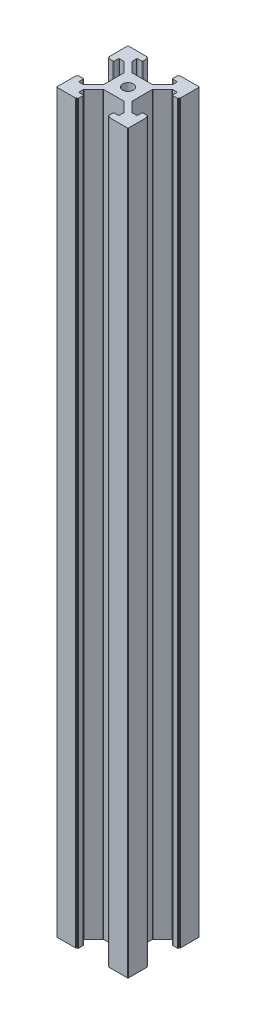
from build123d import *

# Parameters (mm, degrees)
SKETCH1_R               = 1.5
BOSS_EXTRUDE1_DEPTH     = 206
CUT_EXTRUDE1_DEPTH      = 10
CUT_EXTRUDE1_DEPTH_BACK = 10
SKETCH2_R               = 1.5
CUT_EXTRUDE2_DEPTH      = 10
CUT_EXTRUDE2_DEPTH_BACK = 10
SKETCH4_R               = 1.5


with BuildPart() as part:
    # Sketch1 → Boss-Extrude1 (new body)
    with BuildSketch(Plane(origin=(0, 0, 0), x_dir=(1, 0, 0), z_dir=(0, 1, 0))):
        with BuildLine():
            Line((-10, 4.65), (-9.8, 4.65))
            Line((-9.8, 4.65), (-9.8, 4.4))
            ThreePointArc((-9.8, 4.4), (-9.741421356, 4.258578644), (-9.6, 4.2))
            Line((-9.6, 4.2), (-8.4, 4.2))
            ThreePointArc((-8.4, 4.2), (-8.258578644, 4.258578644), (-8.2, 4.4))
            Line((-8.2, 4.4), (-8.2, 5.45))
            ThreePointArc((-8.2, 5.45), (-8.141421356, 5.591421356), (-8, 5.65))
            Line((-8, 5.65), (-6.832842712, 5.65))
            ThreePointArc((-6.832842712, 5.65), (-6.756306026, 5.634775907), (-6.691421356, 5.591421356))
            Line((-6.691421356, 5.591421356), (-4.058578644, 2.958578644))
            ThreePointArc((-4.058578644, 2.958578644), (-4.015224093, 2.893693974), (-4, 2.817157288))
            Line((-4, 2.817157288), (-4, -2.817157288))
            ThreePointArc((-4, -2.817157288), (-4.015224093, -2.893693974), (-4.058578644, -2.958578644))
            Line((-4.058578644, -2.958578644), (-6.691421356, -5.591421356))
            ThreePointArc((-6.691421356, -5.591421356), (-6.756306026, -5.634775907), (-6.832842712, -5.65))
            Line((-6.832842712, -5.65), (-8, -5.65))
            ThreePointArc((-8, -5.65), (-8.141421356, -5.591421356), (-8.2, -5.45))
            Line((-8.2, -5.45), (-8.2, -4.4))
            ThreePointArc((-8.2, -4.4), (-8.258578644, -4.258578644), (-8.4, -4.2))
            Line((-8.4, -4.2), (-9.6, -4.2))
            ThreePointArc((-9.6, -4.2), (-9.741421356, -4.258578644), (-9.8, -4.4))
            Line((-9.8, -4.4), (-9.8, -4.65))
            Line((-9.8, -4.65), (-10, -4.65))
            Line((-10, -4.65), (-10, -9.8))
            ThreePointArc((-10, -9.8), (-9.941421356, -9.941421356), (-9.8, -10))
            Line((-9.8, -10), (-4.65, -10))
            Line((-4.65, -10), (-4.65, -9.8))
            Line((-4.65, -9.8), (-4.4, -9.8))
            ThreePointArc((-4.4, -9.8), (-4.258578644, -9.741421356), (-4.2, -9.6))
            Line((-4.2, -9.6), (-4.2, -8.4))
            ThreePointArc((-4.2, -8.4), (-4.258578644, -8.258578644), (-4.4, -8.2))
            Line((-4.4, -8.2), (-5.45, -8.2))
            ThreePointArc((-5.45, -8.2), (-5.591421356, -8.141421356), (-5.65, -8))
            Line((-5.65, -8), (-5.65, -6.832842712))
            ThreePointArc((-5.65, -6.832842712), (-5.634775907, -6.756306026), (-5.591421356, -6.691421356))
            Line((-5.591421356, -6.691421356), (-2.958578644, -4.058578644))
            ThreePointArc((-2.958578644, -4.058578644), (-2.893693974, -4.015224093), (-2.817157288, -4))
            Line((-2.817157288, -4), (2.817157288, -4))
            ThreePointArc((2.817157288, -4), (2.893693974, -4.015224093), (2.958578644, -4.058578644))
            Line((2.958578644, -4.058578644), (5.591421356, -6.691421356))
            ThreePointArc((5.591421356, -6.691421356), (5.634775907, -6.756306026), (5.65, -6.832842712))
            Line((5.65, -6.832842712), (5.65, -8))
            ThreePointArc((5.65, -8), (5.591421356, -8.141421356), (5.45, -8.2))
            Line((5.45, -8.2), (4.4, -8.2))
            ThreePointArc((4.4, -8.2), (4.258578644, -8.258578644), (4.2, -8.4))
            Line((4.2, -8.4), (4.2, -9.6))
            ThreePointArc((4.2, -9.6), (4.258578644, -9.741421356), (4.4, -9.8))
            Line((4.4, -9.8), (4.65, -9.8))
            Line((4.65, -9.8), (4.65, -10))
            Line((4.65, -10), (9.8, -10))
            ThreePointArc((9.8, -10), (9.941421356, -9.941421356), (10, -9.8))
            Line((10, -9.8), (10, -4.65))
            Line((10, -4.65), (9.8, -4.65))
            Line((9.8, -4.65), (9.8, -4.4))
            ThreePointArc((9.8, -4.4), (9.741421356, -4.258578644), (9.6, -4.2))
            Line((9.6, -4.2), (8.4, -4.2))
            ThreePointArc((8.4, -4.2), (8.258578644, -4.258578644), (8.2, -4.4))
            Line((8.2, -4.4), (8.2, -5.45))
            ThreePointArc((8.2, -5.45), (8.141421356, -5.591421356), (8, -5.65))
            Line((8, -5.65), (6.832842712, -5.65))
            ThreePointArc((6.832842712, -5.65), (6.756306026, -5.634775907), (6.691421356, -5.591421356))
            Line((6.691421356, -5.591421356), (4.058578644, -2.958578644))
            ThreePointArc((4.058578644, -2.958578644), (4.015224093, -2.893693974), (4, -2.817157288))
            Line((4, -2.817157288), (4, 2.817157288))
            ThreePointArc((4, 2.817157288), (4.015224093, 2.893693974), (4.058578644, 2.958578644))
            Line((4.058578644, 2.958578644), (6.691421356, 5.591421356))
            ThreePointArc((6.691421356, 5.591421356), (6.756306026, 5.634775907), (6.832842712, 5.65))
            Line((6.832842712, 5.65), (8, 5.65))
            ThreePointArc((8, 5.65), (8.141421356, 5.591421356), (8.2, 5.45))
            Line((8.2, 5.45), (8.2, 4.4))
            ThreePointArc((8.2, 4.4), (8.258578644, 4.258578644), (8.4, 4.2))
            Line((8.4, 4.2), (9.6, 4.2))
            ThreePointArc((9.6, 4.2), (9.741421356, 4.258578644), (9.8, 4.4))
            Line((9.8, 4.4), (9.8, 4.65))
            Line((9.8, 4.65), (10, 4.65))
            Line((10, 4.65), (10, 9.8))
            ThreePointArc((10, 9.8), (9.941421356, 9.941421356), (9.8, 10))
            Line((9.8, 10), (4.65, 10))
            Line((4.65, 10), (4.65, 9.8))
            Line((4.65, 9.8), (4.4, 9.8))
            ThreePointArc((4.4, 9.8), (4.258578644, 9.741421356), (4.2, 9.6))
            Line((4.2, 9.6), (4.2, 8.4))
            ThreePointArc((4.2, 8.4), (4.258578644, 8.258578644), (4.4, 8.2))
            Line((4.4, 8.2), (5.45, 8.2))
            ThreePointArc((5.45, 8.2), (5.591421356, 8.141421356), (5.65, 8))
            Line((5.65, 8), (5.65, 6.832842712))
            ThreePointArc((5.65, 6.832842712), (5.634775907, 6.756306026), (5.591421356, 6.691421356))
            Line((5.591421356, 6.691421356), (2.958578644, 4.058578644))
            ThreePointArc((2.958578644, 4.058578644), (2.893693974, 4.015224093), (2.817157288, 4))
            Line((2.817157288, 4), (-2.817157288, 4))
            ThreePointArc((-2.817157288, 4), (-2.893693974, 4.015224093), (-2.958578644, 4.058578644))
            Line((-2.958578644, 4.058578644), (-5.591421356, 6.691421356))
            ThreePointArc((-5.591421356, 6.691421356), (-5.634775907, 6.756306026), (-5.65, 6.832842712))
            Line((-5.65, 6.832842712), (-5.65, 8))
            ThreePointArc((-5.65, 8), (-5.591421356, 8.141421356), (-5.45, 8.2))
            Line((-5.45, 8.2), (-4.4, 8.2))
            ThreePointArc((-4.4, 8.2), (-4.258578644, 8.258578644), (-4.2, 8.4))
            Line((-4.2, 8.4), (-4.2, 9.6))
            ThreePointArc((-4.2, 9.6), (-4.258578644, 9.741421356), (-4.4, 9.8))
            Line((-4.4, 9.8), (-4.65, 9.8))
            Line((-4.65, 9.8), (-4.65, 10))
            Line((-4.65, 10), (-9.8, 10))
            ThreePointArc((-9.8, 10), (-9.941421356, 9.941421356), (-10, 9.8))
            Line((-10, 9.8), (-10, 4.65))
        make_face()
        with Locations(Location((0, 0, 0), (0, 0, 270))):
            Circle(SKETCH1_R, mode=Mode.SUBTRACT)
    extrude(amount=BOSS_EXTRUDE1_DEPTH)

    # Sketch2 → Cut-Extrude1 (cut, two sides: drawn at the far end of the back side and taken through both)
    with BuildSketch(Plane(origin=(4, 0, 0), x_dir=(0, 0, -1), z_dir=(1, 0, 0)).offset(-CUT_EXTRUDE1_DEPTH_BACK)):
        with Locations((0, 103)):
            Circle(SKETCH2_R)
    extrude(amount=CUT_EXTRUDE1_DEPTH + CUT_EXTRUDE1_DEPTH_BACK, mode=Mode.SUBTRACT)

    # Sketch4 → Cut-Extrude2 (cut, two sides: drawn at the far end of the back side and taken through both)
    with BuildSketch(Plane.XY.offset(4).offset(-CUT_EXTRUDE2_DEPTH_BACK)):
        with Locations(Location((0, 103, 0), (0, 0, 180))):
            Circle(SKETCH4_R)
    extrude(amount=CUT_EXTRUDE2_DEPTH + CUT_EXTRUDE2_DEPTH_BACK, mode=Mode.SUBTRACT)


solid = part.part
